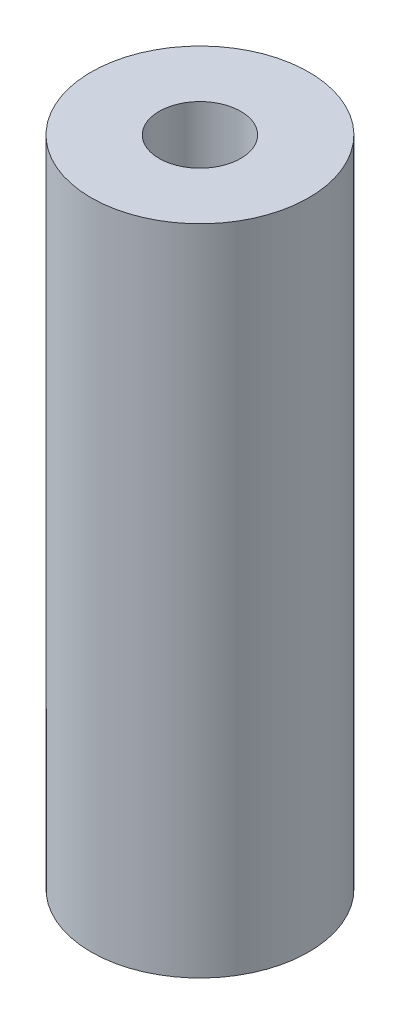
from build123d import *

# Parameters (mm, degrees)
SKETCH1_R           = 4
BOSS_EXTRUDE1_DEPTH = 24
SKETCH2_R           = 1.5
CUT_EXTRUDE1_DEPTH  = 25.657656012


with BuildPart() as part:
    # Sketch1 → Boss-Extrude1 (new body)
    with BuildSketch(Plane(origin=(0, 0, 0), x_dir=(1, 0, 0), z_dir=(0, 1, 0))):
        with Locations(Location((0, 0, 0), (0, 0, 270))):
            Circle(SKETCH1_R)
    extrude(amount=BOSS_EXTRUDE1_DEPTH)

    # Sketch2 → Cut-Extrude1 (cut, through all)
    with BuildSketch(Plane(origin=(0, 24, 0), x_dir=(1, 0, 0), z_dir=(0, 1, 0))):
        with Locations(Location((0, 0, 0), (0, 0, 270))):
            Circle(SKETCH2_R)
    extrude(amount=-CUT_EXTRUDE1_DEPTH, mode=Mode.SUBTRACT)


solid = part.part
